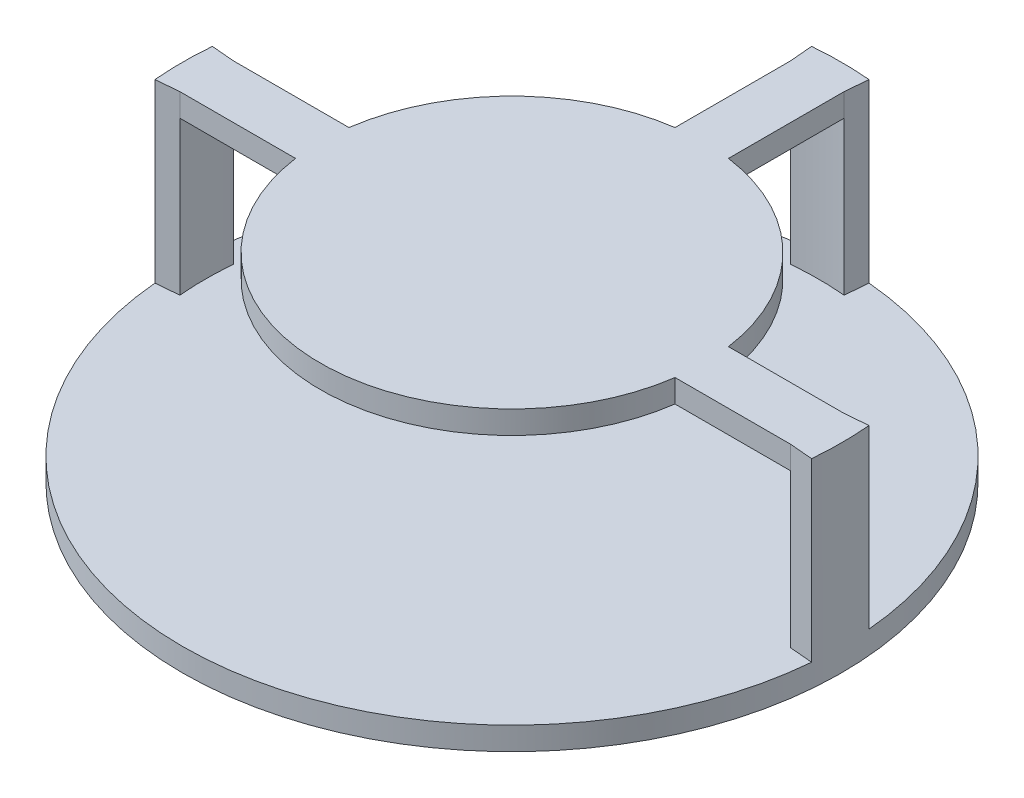
from build123d import *

# Parameters (mm, degrees)
SKETCH1_R           = 43
BOSS_EXTRUDE1_DEPTH = 3
BOSS_EXTRUDE2_DEPTH = 20
BOSS_EXTRUDE3_DEPTH = 3


with BuildPart() as part:
    # Sketch1 → Boss-Extrude1 (new body)
    with BuildSketch(Plane(origin=(0, 0, 0), x_dir=(1, 0, 0), z_dir=(0, 1, 0))):
        with Locations(Location((0, 0, 0), (0, 0, 270))):
            Circle(SKETCH1_R)
    extrude(amount=BOSS_EXTRUDE1_DEPTH)

    # Sketch2 → Boss-Extrude2 (add)
    with BuildSketch(Plane(origin=(0, 3, 0), x_dir=(1, 0, 0), z_dir=(0, 1, 0))):
        with BuildLine():
            Line((-43, 0), (-39.99995453, 0))
            ThreePointArc((-39.99995453, 0), (-39.961883436, 1.744773511), (-39.847742626, 3.486225747))
            Line((-39.847742626, 3.486225747), (-42.836372018, 3.747696938))
            ThreePointArc((-42.836372018, 3.747696938), (-42.959073528, 1.875633657), (-43, 0))
        make_face()
        with BuildLine():
            ThreePointArc((-39.847742626, -3.486225747), (-39.961883436, -1.744773511), (-39.99995453, 0))
            Line((-39.99995453, 0), (-43, 0))
            ThreePointArc((-43, 0), (-42.959073528, -1.875633657), (-42.836372018, -3.747696938))
            Line((-42.836372018, -3.747696938), (-39.847742626, -3.486225747))
        make_face()
        with BuildLine():
            ThreePointArc((39.847742626, 3.486225747), (39.961883436, 1.744773511), (39.99995453, 0))
            Line((39.99995453, 0), (43, 0))
            ThreePointArc((43, 0), (42.959073528, 1.875633657), (42.836372018, 3.747696938))
            Line((42.836372018, 3.747696938), (39.847742626, 3.486225747))
        make_face()
        with BuildLine():
            Line((43, 0), (39.99995453, 0))
            ThreePointArc((39.99995453, 0), (39.961883436, -1.744773511), (39.847742626, -3.486225747))
            Line((39.847742626, -3.486225747), (42.836372018, -3.747696938))
            ThreePointArc((42.836372018, -3.747696938), (42.959073528, -1.875633657), (43, 0))
        make_face()
        with BuildLine():
            Line((0, 43), (0, 39.99995453))
            ThreePointArc((0, 39.99995453), (1.744773511, 39.961883436), (3.486225747, 39.847742626))
            Line((3.486225747, 39.847742626), (3.747696938, 42.836372018))
            ThreePointArc((3.747696938, 42.836372018), (1.875633657, 42.959073528), (0, 43))
        make_face()
        with BuildLine():
            ThreePointArc((-3.486225747, 39.847742626), (-1.744773511, 39.961883436), (0, 39.99995453))
            Line((0, 39.99995453), (0, 43))
            ThreePointArc((0, 43), (-1.875633657, 42.959073528), (-3.747696938, 42.836372018))
            Line((-3.747696938, 42.836372018), (-3.486225747, 39.847742626))
        make_face()
    extrude(amount=BOSS_EXTRUDE2_DEPTH)

    # Sketch3 → Boss-Extrude3 (add)
    with BuildSketch(Plane(origin=(0, 23, 0), x_dir=(1, 0, 0), z_dir=(0, 1, 0))):
        with BuildLine():
            Line((-42.836372018, -3.747696938), (-39.847742626, -3.486225747))
            Line((-39.847742626, -3.486225747), (-24.755731256, -3.486225747))
            ThreePointArc((-24.755731256, -3.486225747), (0, -25), (24.755731256, -3.486225747))
            Line((24.755731256, -3.486225747), (39.847742626, -3.486225747))
            Line((39.847742626, -3.486225747), (42.836372018, -3.747696938))
            ThreePointArc((42.836372018, -3.747696938), (43, 0), (42.836372018, 3.747696938))
            Line((42.836372018, 3.747696938), (39.847742626, 3.486225747))
            Line((39.847742626, 3.486225747), (24.755731256, 3.486225747))
            ThreePointArc((24.755731256, 3.486225747), (17.67766953, 17.67766953), (3.486225747, 24.755731256))
            Line((3.486225747, 24.755731256), (3.486225747, 39.847742626))
            Line((3.486225747, 39.847742626), (3.747696938, 42.836372018))
            ThreePointArc((3.747696938, 42.836372018), (0, 43), (-3.747696938, 42.836372018))
            Line((-3.747696938, 42.836372018), (-3.486225747, 39.847742626))
            Line((-3.486225747, 39.847742626), (-3.486225747, 24.755731256))
            ThreePointArc((-3.486225747, 24.755731256), (-17.67766953, 17.67766953), (-24.755731256, 3.486225747))
            Line((-24.755731256, 3.486225747), (-39.847742626, 3.486225747))
            Line((-39.847742626, 3.486225747), (-42.836372018, 3.747696938))
            ThreePointArc((-42.836372018, 3.747696938), (-43, 0), (-42.836372018, -3.747696938))
        make_face()
    extrude(amount=BOSS_EXTRUDE3_DEPTH)


solid = part.part
